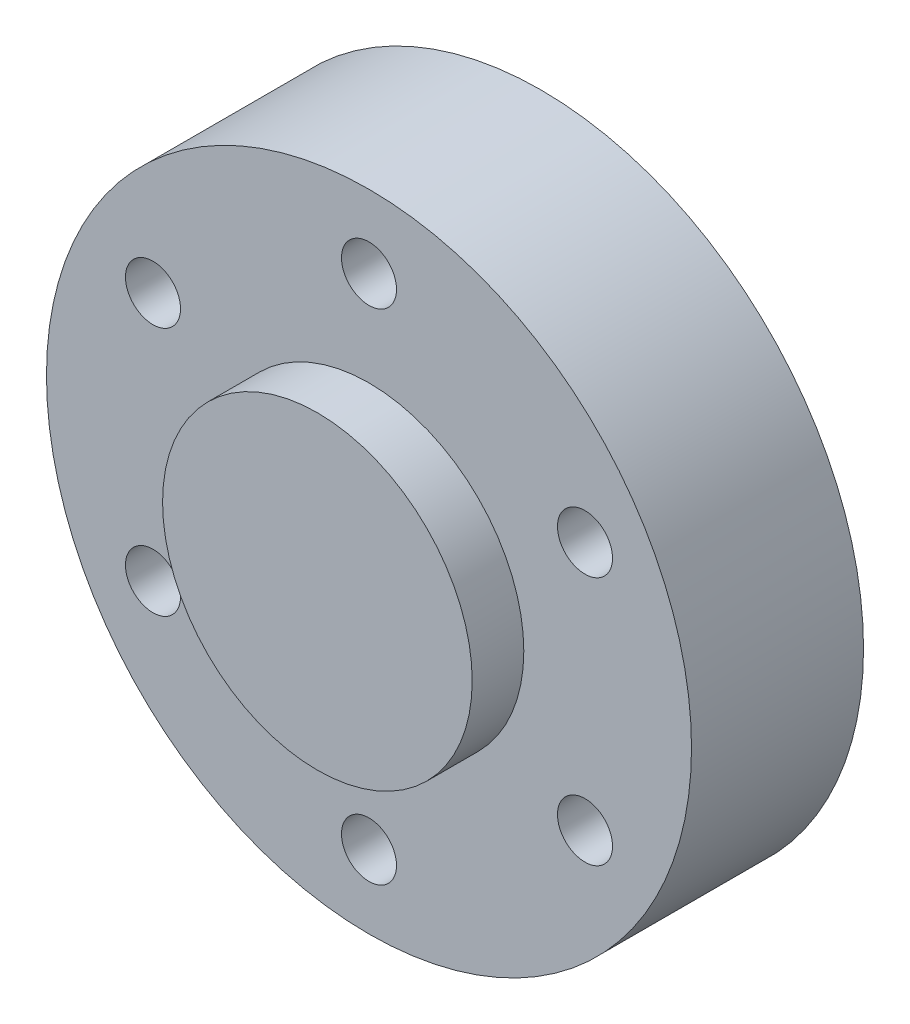
from build123d import *

# Parameters (mm, degrees)
SKETCH2_R           = 18.75
SKETCH2_R_2         = 1.6
BOSS_EXTRUDE1_DEPTH = 10
SKETCH3_R           = 9
BOSS_EXTRUDE2_DEPTH = 3
BOSS_EXTRUDE4_START = 3
SKETCH6_R           = 9
BOSS_EXTRUDE4_DEPTH = 3
SKETCH7_R           = 1.6
BOSS_EXTRUDE5_DEPTH = 1
FILLET2_R           = 0.05
SKETCH9_R           = 1.4
CUT_EXTRUDE1_DEPTH  = 10


with BuildPart() as part:
    # Sketch2 → Boss-Extrude1 (new body)
    with BuildSketch(Plane.XY):
        Circle(SKETCH2_R)
        with Locations((0, 14.5)):
            Circle(SKETCH2_R_2, mode=Mode.SUBTRACT)
        with Locations((12.557368355, 7.25)):
            Circle(SKETCH2_R_2, mode=Mode.SUBTRACT)
        with Locations((12.557368355, -7.25)):
            Circle(SKETCH2_R_2, mode=Mode.SUBTRACT)
        with Locations((0, -14.5)):
            Circle(SKETCH2_R_2, mode=Mode.SUBTRACT)
        with Locations((-12.557368355, -7.25)):
            Circle(SKETCH2_R_2, mode=Mode.SUBTRACT)
        with Locations((-12.557368355, 7.25)):
            Circle(SKETCH2_R_2, mode=Mode.SUBTRACT)
    extrude(amount=BOSS_EXTRUDE1_DEPTH)

    # Sketch3 → Boss-Extrude2 (add)
    with BuildSketch(Plane.XY.offset(10)):
        Circle(SKETCH3_R)
    extrude(amount=BOSS_EXTRUDE2_DEPTH)

    # Sketch6 → Boss-Extrude4 (add)
    with BuildSketch(Plane(origin=(0, 0, 0), x_dir=(-1, 0, 0), z_dir=(0, 0, -1)).offset(BOSS_EXTRUDE4_START)):
        with Locations(Location((0, 0, 0), (0, 0, 180))):
            Circle(SKETCH6_R)
    extrude(amount=-BOSS_EXTRUDE4_DEPTH)

    # Sketch7 → Boss-Extrude5 (add)
    with BuildSketch(Plane(origin=(0, 0, -3), x_dir=(-1, 0, 0), z_dir=(0, 0, -1))):
        Circle(SKETCH7_R)
    extrude(amount=BOSS_EXTRUDE5_DEPTH)

    # Fillet2
    fillet2_edges = [part.edges().sort_by_distance(p)[0] for p in [
        (1.6, 0, -4),
    ]]
    fillet(fillet2_edges, radius=FILLET2_R)

    # Sketch9 → Cut-Extrude1 (cut)
    with BuildSketch(Plane(origin=(0, 0, -4), x_dir=(-1, 0, 0), z_dir=(0, 0, -1))):
        Circle(SKETCH9_R)
    extrude(amount=-CUT_EXTRUDE1_DEPTH, mode=Mode.SUBTRACT)


solid = part.part
